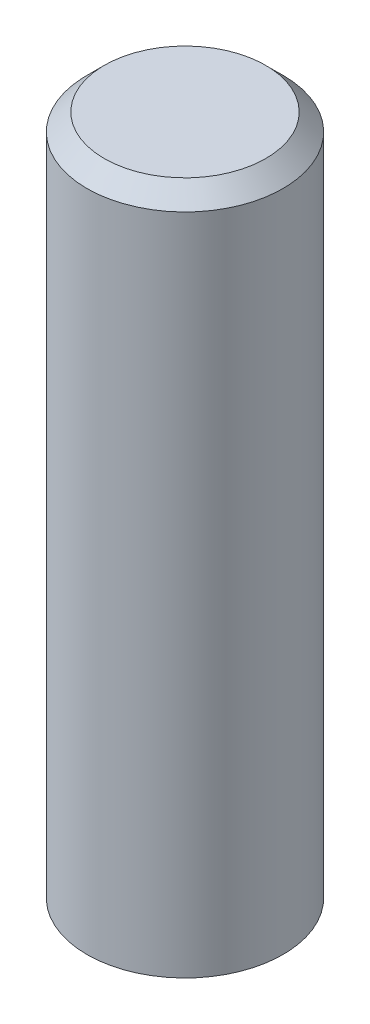
from build123d import *


with BuildPart() as part:
    # Sketch1 → Revolve1 (revolve)
    with BuildSketch(Plane(origin=(0, 0, 0), x_dir=(-1, 0, 0), z_dir=(0, 0, -1)), mode=Mode.PRIVATE) as revolve1_sk:
        Polygon((-1.7, 0), (0, 0), (0, 11.8), (-1.4, 11.8), (-1.7, 11.5), align=None)
    revolve(revolve1_sk.sketch.rotate(Axis((0, 0, 0), (0, 1, 0)), 270), axis=Axis((0, 0, 0), (0, 1, 0)))


solid = part.part
